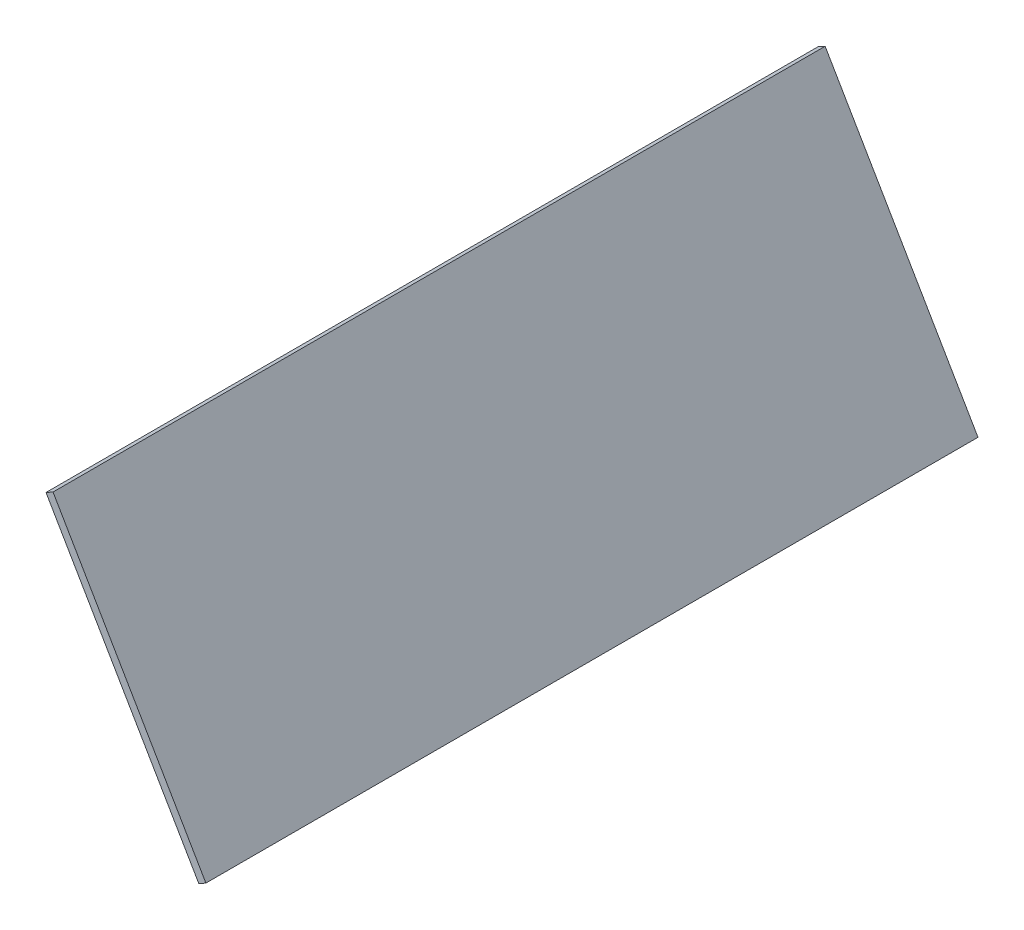
from build123d import *

# Parameters (mm, degrees)
SLOPING_ELECTRONICS_BULKHEAD_DEPTH = 198


with BuildPart() as part:
    # Sloping electronics bulkhead profile → Sloping electronics bulkhead (new body)
    with BuildSketch(Plane.XY):
        Polygon((54, 103), (55.8, 104), (95, 36.75), (93.2, 35.7), align=None)
    extrude(amount=SLOPING_ELECTRONICS_BULKHEAD_DEPTH)


solid = part.part
